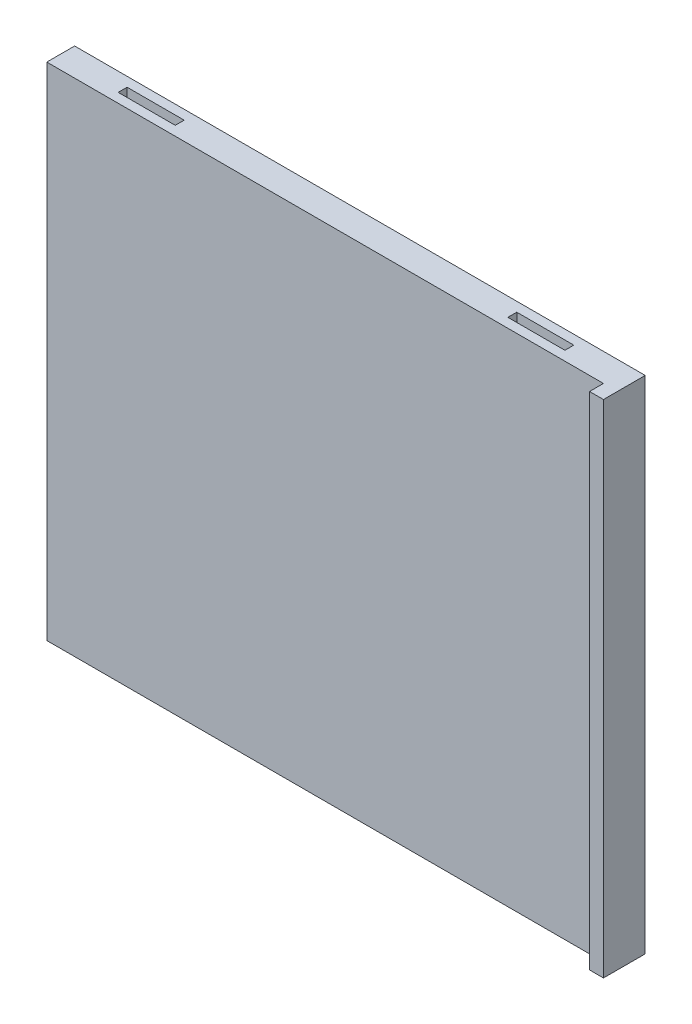
from build123d import *

# Parameters (mm, degrees)
SKETCH1_W           = 180
SKETCH1_H           = 205
BOSS_EXTRUDE1_DEPTH = 10
SKETCH2_W           = 5
SKETCH2_H           = 180
BOSS_EXTRUDE2_DEPTH = 5
SKETCH5_W           = 21
SKETCH5_H           = 3.5
CUT_EXTRUDE3_DEPTH  = 10
SKETCH6_W           = 20.5
SKETCH6_H           = 3.2
CUT_EXTRUDE4_DEPTH  = 10


with BuildPart() as part:
    # Sketch1 → Boss-Extrude1 (new body)
    with BuildSketch(Plane(origin=(0, 0, 0), x_dir=(0, 1, 0), z_dir=(0, 0, 1))):
        Rectangle(SKETCH1_W, SKETCH1_H)
    extrude(amount=BOSS_EXTRUDE1_DEPTH)

    # Sketch2 → Boss-Extrude2 (add)
    with BuildSketch(Plane.XY.offset(10)):
        with Locations((100, 0)):
            Rectangle(SKETCH2_W, SKETCH2_H)
    extrude(amount=BOSS_EXTRUDE2_DEPTH)

    # Sketch5 → Cut-Extrude3 (cut)
    with BuildSketch(Plane(origin=(-102.5, 0, 0), x_dir=(0, -1, 0), z_dir=(-1, 0, 0))):
        with Locations((-40.5, 5)):
            Rectangle(SKETCH5_W, SKETCH5_H)
        with Locations((40.5, 5)):
            Rectangle(SKETCH5_W, SKETCH5_H)
    extrude(amount=-CUT_EXTRUDE3_DEPTH, mode=Mode.SUBTRACT)

    # Sketch6 → Cut-Extrude4 (cut)
    with BuildSketch(Plane.XZ.offset(90)):
        with Locations((70, 5)):
            Rectangle(SKETCH6_W, SKETCH6_H)
        with Locations((-70, 5)):
            Rectangle(SKETCH6_W, SKETCH6_H)
    cut_extrude4 = extrude(amount=-CUT_EXTRUDE4_DEPTH, mode=Mode.SUBTRACT)

    # Mirror1: Cut-Extrude4 across plane
    add(cut_extrude4.mirror(Plane.ZX), mode=Mode.SUBTRACT)


solid = part.part
